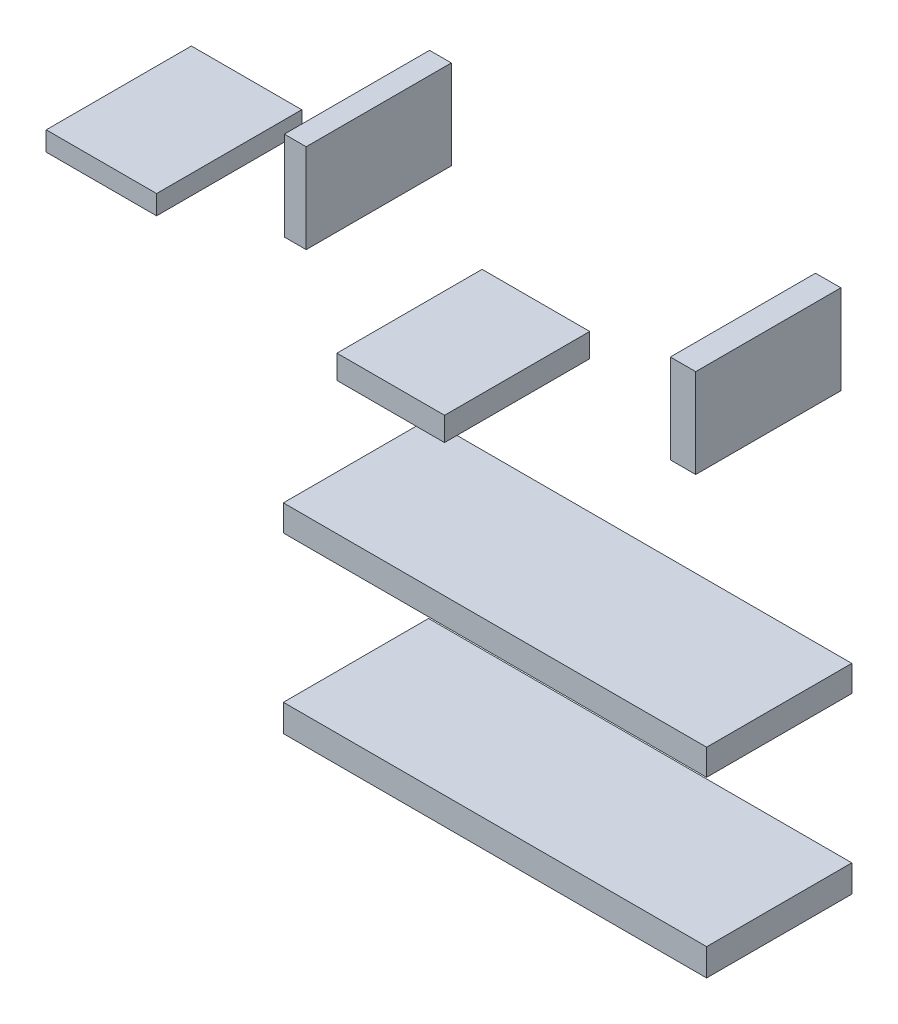
from build123d import *

# Parameters (mm, degrees)
IZIM1_W                       = 9.63702019
IZIM1_H                       = 2.118777488
Y_KSEKLIK_EKSTR_ZYON1_DEPTH   = 13
IZIM1_W_2                     = 9.883488483
IZIM1_H_2                     = 1.732843856
Y_KSEKLIK_EKSTR_ZYON1_2_DEPTH = 13
IZIM1_W_3                     = 1.953921658
IZIM1_H_3                     = 7.983165628
Y_KSEKLIK_EKSTR_ZYON1_3_DEPTH = 13
IZIM1_W_4                     = 37.9
IZIM1_H_4                     = 2.34
Y_KSEKLIK_EKSTR_ZYON1_4_DEPTH = 13
IZIM1_W_5                     = 2.269294049
Y_KSEKLIK_EKSTR_ZYON1_5_DEPTH = 13
IZIM1_H_5                     = 2.43358359
Y_KSEKLIK_EKSTR_ZYON1_6_DEPTH = 13


with BuildPart() as part:
    # Çizim1 → Yükseklik-Ekstrüzyon1 (new body)
    with BuildSketch(Plane.XY):
        with Locations((3.857574093, -2.55176148)):
            Rectangle(IZIM1_W, IZIM1_H)
    extrude(amount=-Y_KSEKLIK_EKSTR_ZYON1_DEPTH)


with BuildPart() as body_2:
    # Çizim1 → Y_kseklik-Ekstr_zyon1 2 (new body)
    with BuildSketch(Plane.XY):
        with Locations((-22.053241935, 1.943207046)):
            Rectangle(IZIM1_W_2, IZIM1_H_2)
    extrude(amount=-Y_KSEKLIK_EKSTR_ZYON1_2_DEPTH)


with BuildPart() as body_3:
    # Çizim1 → Y_kseklik-Ekstr_zyon1 3 (new body)
    with BuildSketch(Plane.XY):
        with Locations((-4.692366118, 9.145917777)):
            Rectangle(IZIM1_W_3, IZIM1_H_3)
    extrude(amount=-Y_KSEKLIK_EKSTR_ZYON1_3_DEPTH)


with BuildPart() as body_4:
    # Çizim1 → Y_kseklik-Ekstr_zyon1 4 (new body)
    with BuildSketch(Plane.XY):
        with Locations((13.19451837, -16.67)):
            Rectangle(IZIM1_W_4, IZIM1_H_4)
    extrude(amount=-Y_KSEKLIK_EKSTR_ZYON1_4_DEPTH)


with BuildPart() as body_5:
    # Çizim1 → Y_kseklik-Ekstr_zyon1 5 (new body)
    with BuildSketch(Plane.XY):
        with Locations((30.031922134, 9.145917777)):
            Rectangle(IZIM1_W_5, IZIM1_H_3)
    extrude(amount=-Y_KSEKLIK_EKSTR_ZYON1_5_DEPTH)


with BuildPart() as body_6:
    # Çizim1 → Y_kseklik-Ekstr_zyon1 6 (new body)
    with BuildSketch(Plane.XY):
        with Locations((13.19451837, -32.183208205)):
            Rectangle(IZIM1_W_4, IZIM1_H_5)
    extrude(amount=-Y_KSEKLIK_EKSTR_ZYON1_6_DEPTH)


solid = Compound([part.part, body_2.part, body_3.part, body_4.part, body_5.part, body_6.part])
